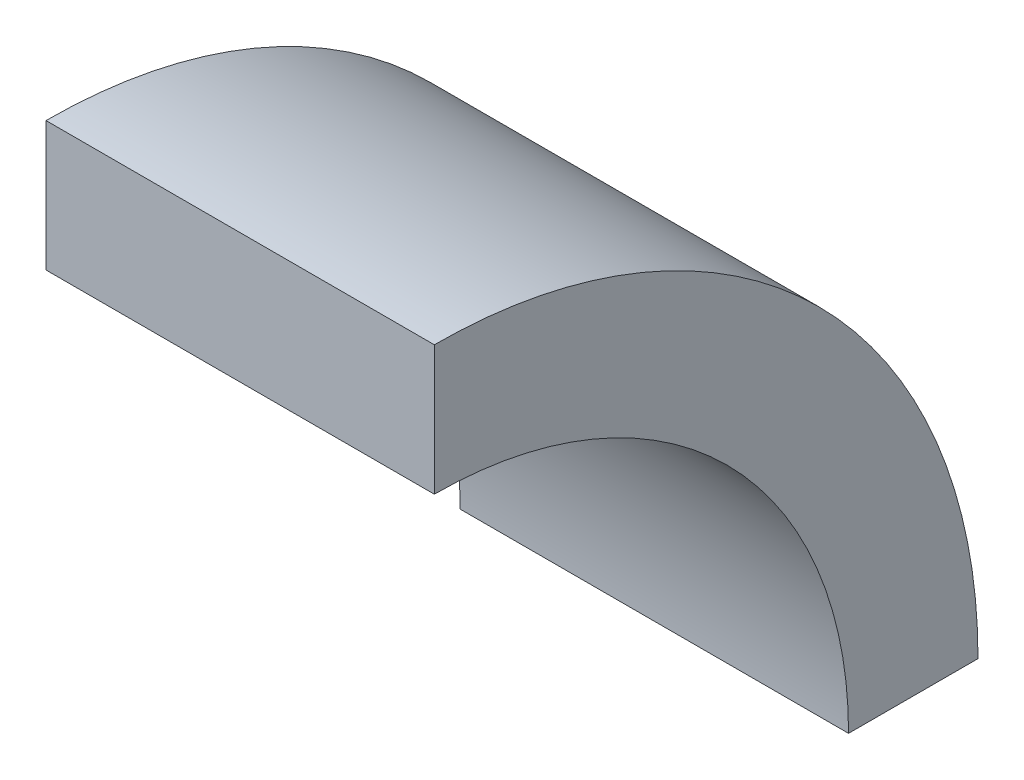
from build123d import *

# Parameters (mm, degrees)
SKETCH1_W      = 30
SKETCH1_H      = 10
REVOLVE2_ANGLE = 90


with BuildPart() as part:
    # Sketch1 → Revolve2 (revolve)
    with BuildSketch(Plane(origin=(0, 0, 0), x_dir=(1, 0, 0), z_dir=(0, 1, 0))):
        Rectangle(SKETCH1_W, SKETCH1_H)
    revolve(axis=Axis((-19.989025937, 0, 37), (1, 0, 0)), revolution_arc=REVOLVE2_ANGLE)


solid = part.part
